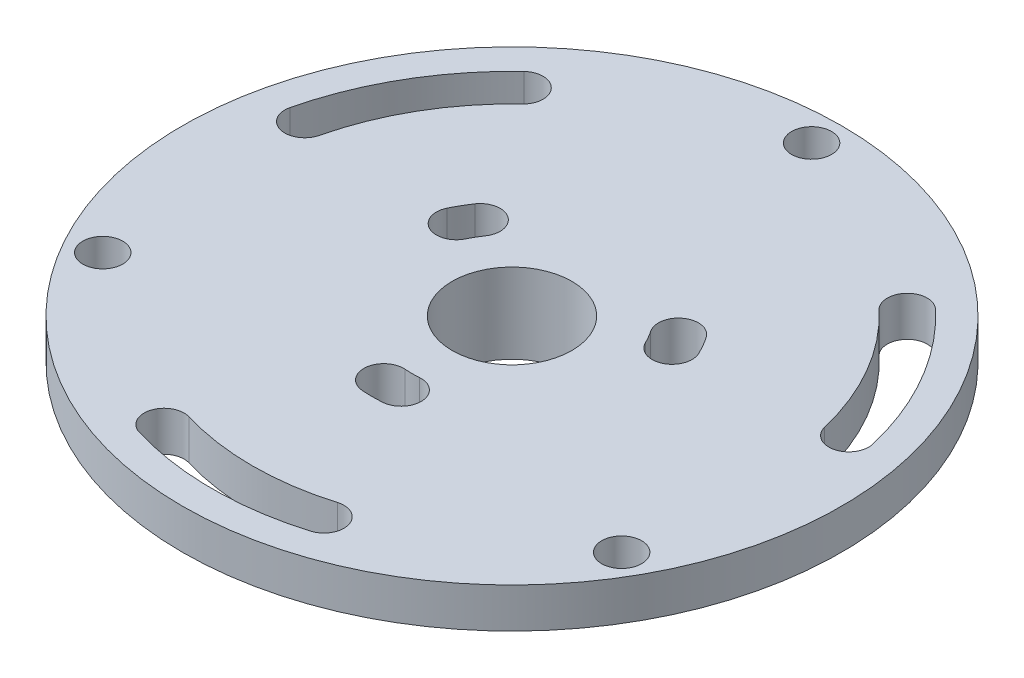
from build123d import *
from build123d.topology import SkipClean

# Parameters (mm, degrees)
SKETCH_1_R          = 16.5
SKETCH_1_R_2        = 1
SKETCH_1_R_3        = 3
EXTRUDE_1_DEPTH     = 2
EXTRUDE_START       = 2
SKETCH_2_R          = 4
SKETCH_2_R_2        = 3
EXTRUDE_2_DEPTH     = 2
CUT_EXTRUDE_1_DEPTH = 2


with BuildPart() as part:
    # 草图1 → 凸台-拉伸1 (new body)
    with BuildSketch(Plane(origin=(0, 0, 0), x_dir=(1, 0, 0), z_dir=(0, 1, 0))):
        with Locations(Location((0, 0, 0), (0, 0, 270))):
            Circle(SKETCH_1_R)
        with Locations(Location((0, 15, 0), (0, 0, 270))):
            Circle(SKETCH_1_R_2, mode=Mode.SUBTRACT)
        with Locations(Location((0, 0, 0), (0, 0, 270))):
            Circle(SKETCH_1_R_3, mode=Mode.SUBTRACT)
        with Locations(Location((12.990381057, -7.5, 0), (0, 0, 270))):
            Circle(SKETCH_1_R_2, mode=Mode.SUBTRACT)
        with Locations(Location((-12.990381057, -7.5, 0), (0, 0, 270))):
            Circle(SKETCH_1_R_2, mode=Mode.SUBTRACT)
    extrude(amount=EXTRUDE_1_DEPTH)

    # 草图2 → 凸台-拉伸2 (add)
    with SkipClean():  # the faces are left unmerged after this step: merging them gives an invalid solid
        with BuildSketch(Plane.XZ.offset(EXTRUDE_START)):
            with Locations(Location((0, 0, 0), (0, 0, 90))):
                Circle(SKETCH_2_R)
            with Locations(Location((0, 0, 0), (0, 0, 270))):
                Circle(SKETCH_2_R_2, mode=Mode.SUBTRACT)
        extrude(amount=-EXTRUDE_2_DEPTH)

    # 草图3 → 切除-拉伸1 (cut)
    with SkipClean():  # the faces are left unmerged after this step: merging them gives an invalid solid
        with BuildSketch(Plane(origin=(0, 2, 0), x_dir=(1, 0, 0), z_dir=(0, 1, 0))):
            with BuildLine():
                ThreePointArc((14.591807471, 3.475507836), (12.990381057, 7.5), (10.305781813, 10.899122039))
                ThreePointArc((10.305781813, 10.899122039), (8.892121556, 10.859566024), (8.931677571, 9.445905767))
                ThreePointArc((8.931677571, 9.445905767), (11.258330249, 6.5), (12.646233142, 3.012106791))
                ThreePointArc((12.646233142, 3.012106791), (13.850720829, 2.271020149), (14.591807471, 3.475507836))
            make_face()
            with BuildLine():
                ThreePointArc((6.299818145, 3.051604716), (6.062177826, 3.5), (5.792676279, 3.930000194))
                ThreePointArc((5.792676279, 3.930000194), (4.403722497, 4.196096778), (4.137625913, 2.807142996))
                ThreePointArc((4.137625913, 2.807142996), (4.330127019, 2.5), (4.499870103, 2.179717654))
                ThreePointArc((4.499870103, 2.179717654), (5.835787655, 1.715687165), (6.299818145, 3.051604716))
            make_face()
            with BuildLine():
                ThreePointArc((-4.286025658, -14.374629875), (0, -15), (4.286025658, -14.374629875))
                ThreePointArc((4.286025658, -14.374629875), (4.958599273, -13.130586173), (3.714555571, -12.458012559))
                ThreePointArc((3.714555571, -12.458012559), (0, -13), (-3.714555571, -12.458012559))
                ThreePointArc((-3.714555571, -12.458012559), (-4.958599273, -13.130586173), (-4.286025658, -14.374629875))
            make_face()
            with BuildLine():
                ThreePointArc((-0.507141866, -6.981604911), (0, -7), (0.507141866, -6.981604911))
                ThreePointArc((0.507141866, -6.981604911), (1.432065158, -5.911783943), (0.36224419, -4.98686065))
                ThreePointArc((0.36224419, -4.98686065), (0, -5), (-0.36224419, -4.98686065))
                ThreePointArc((-0.36224419, -4.98686065), (-1.432065158, -5.911783943), (-0.507141866, -6.981604911))
            make_face()
            with BuildLine():
                ThreePointArc((-10.305781813, 10.899122039), (-12.990381057, 7.5), (-14.591807471, 3.475507836))
                ThreePointArc((-14.591807471, 3.475507836), (-13.850720829, 2.271020149), (-12.646233142, 3.012106791))
                ThreePointArc((-12.646233142, 3.012106791), (-11.258330249, 6.5), (-8.931677571, 9.445905767))
                ThreePointArc((-8.931677571, 9.445905767), (-8.892121556, 10.859566024), (-10.305781813, 10.899122039))
            make_face()
            with BuildLine():
                ThreePointArc((-5.792676279, 3.930000194), (-6.062177826, 3.5), (-6.299818145, 3.051604716))
                ThreePointArc((-6.299818145, 3.051604716), (-5.835787655, 1.715687165), (-4.499870103, 2.179717654))
                ThreePointArc((-4.499870103, 2.179717654), (-4.330127019, 2.5), (-4.137625913, 2.807142996))
                ThreePointArc((-4.137625913, 2.807142996), (-4.403722497, 4.196096778), (-5.792676279, 3.930000194))
            make_face()
        extrude(amount=-CUT_EXTRUDE_1_DEPTH, mode=Mode.SUBTRACT)


solid = part.part
